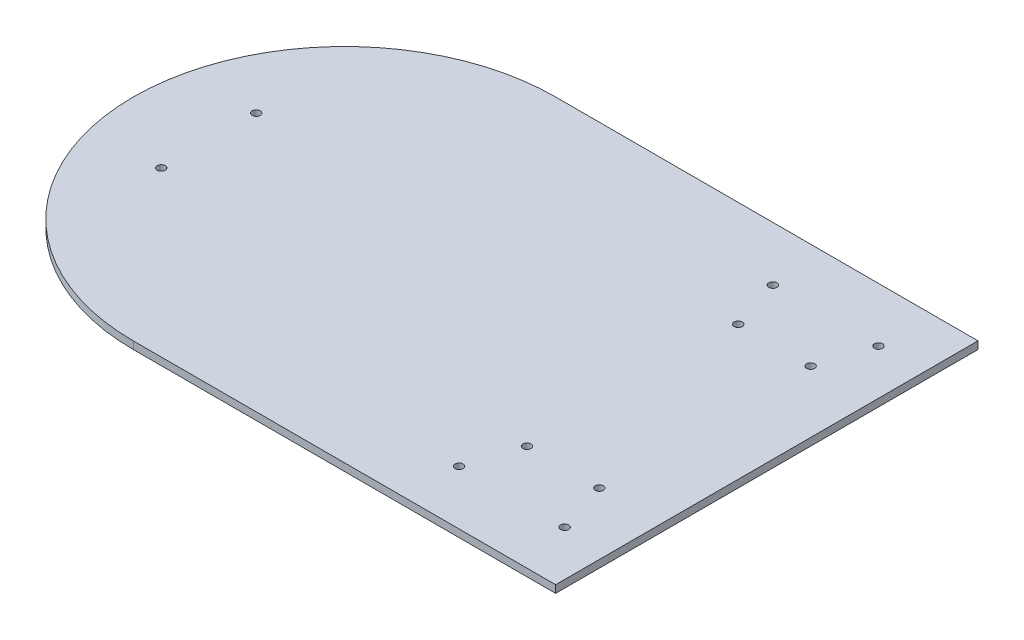
from build123d import *

# Parameters (mm, degrees)
BOSS_EXTRUDE1_DEPTH  = 3.175
M3_CLEARANCE_HOLE1_D = 3.4


with BuildPart() as part:
    # Sketch2 → Boss-Extrude1 (new body)
    with BuildSketch(Plane(origin=(0, 0, 0), x_dir=(1, 0, 0), z_dir=(0, 1, 0))):
        with BuildLine():
            Line((0, 0), (0, 177.8))
            Line((0, 177.8), (-177.8, 177.8))
            ThreePointArc((-177.8, 177.8), (-266.7, 88.9), (-177.8, 0))
            Line((-177.8, 0), (0, 0))
        make_face()
    extrude(amount=BOSS_EXTRUDE1_DEPTH)

    # M3 Clearance Hole1 (through all)
    with Locations(Plane(origin=(0, 3.175, 0), x_dir=(1, 0, 0), z_dir=(0, 1, 0))):
        with Locations((-63.5, 154.95524), (-19.05, 154.95524), (-56.515, 133.36524), (-26.035, 133.36524), (-56.515, 44.43476), (-26.035, 44.43476), (-63.5, 22.84476), (-19.05, 22.84476), (-234.95, 108.9), (-234.95, 68.9)):
            Hole(M3_CLEARANCE_HOLE1_D / 2)


solid = part.part
